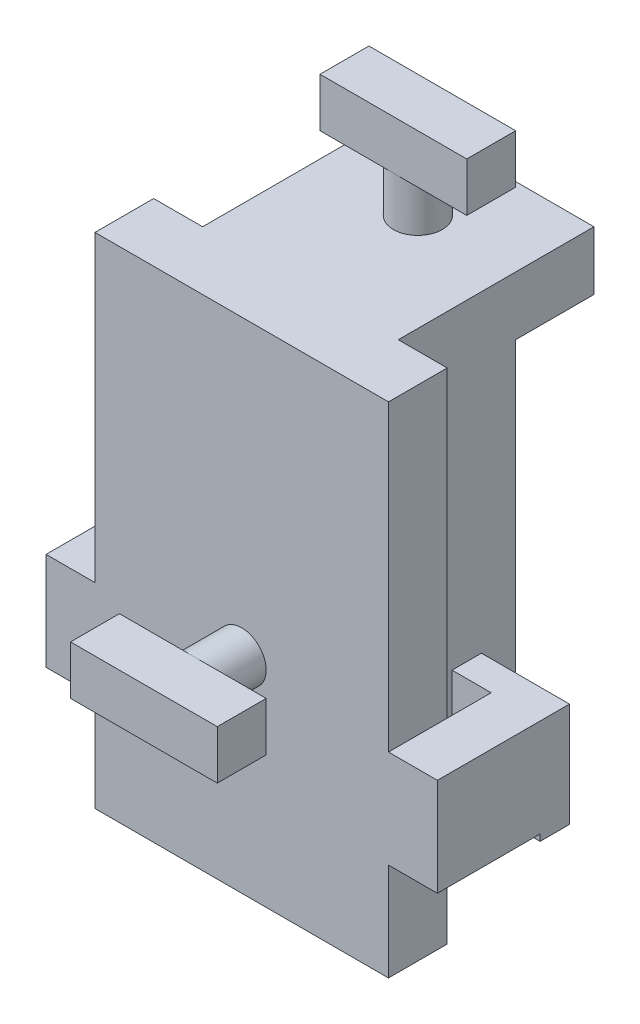
from build123d import *

# Parameters (mm, degrees)
SKETCH_1_W               = 20
SKETCH_1_H               = 45
EXTRUDE_1_DEPTH          = 12
SKETCH_2_W               = 20
SKETCH_2_H               = 20
SKETCH_2_R               = 1.5
EXTRUDE_2_DEPTH          = 6
CUT_EXTRUDE_1_DEPTH      = 57.080299571
CUT_EXTRUDE_1_DEPTH_BACK = 57.080299571
SKETCH_3_R               = 1.5
SKETCH_4_W               = 30
SKETCH_4_H               = 51
EXTRUDE_3_DEPTH          = 6
SKETCH_5_W               = 10.5
SKETCH_5_H               = 10
EXTRUDE_4_DEPTH          = 5
SKETCH_6_W               = 9
SKETCH_6_H               = 10.658350912
EXTRUDE_5_DEPTH          = 3
SKETCH_7_W               = 10.5
SKETCH_7_H               = 10
EXTRUDE_6_DEPTH          = 5
SKETCH_8_W               = 9
SKETCH_8_H               = 10.144867035
EXTRUDE_7_DEPTH          = 3
SKETCH_9_R               = 2.5
EXTRUDE_8_DEPTH          = 10
SKETCH_10_W              = 15
SKETCH_10_H              = 5
EXTRUDE_9_DEPTH          = 5
SKETCH_11_R              = 2.5
EXTRUDE_10_DEPTH         = 10
SKETCH_12_W              = 15
SKETCH_12_H              = 5
EXTRUDE_11_DEPTH         = 5


with BuildPart() as part:
    # ｽｹｯﾁ1 → ﾎﾞｽ - 押し出し1 (new body)
    with BuildSketch(Plane.XY):
        with Locations((10, 22.5)):
            Rectangle(SKETCH_1_W, SKETCH_1_H)
    extrude(amount=EXTRUDE_1_DEPTH)

    # ｽｹｯﾁ2 → ﾎﾞｽ - 押し出し2 (add)
    with BuildSketch(Plane(origin=(0, 45, 0), x_dir=(1, 0, 0), z_dir=(0, 1, 0))):
        with Locations((10, -2)):
            Rectangle(SKETCH_2_W, SKETCH_2_H)
        with Locations(Location((10, 5, 0), (0, 0, 270))):
            Circle(SKETCH_2_R, mode=Mode.SUBTRACT)
    extrude(amount=EXTRUDE_2_DEPTH)

    # ｽｹｯﾁ3 → ｶｯﾄ - 押し出し1 (cut, two sides: drawn at the far end of the back side and taken through both)
    with BuildSketch(Plane(origin=(20, 0, 0), x_dir=(0, 0, -1), z_dir=(1, 0, 0)).offset(-CUT_EXTRUDE_1_DEPTH_BACK)):
        with Locations(Location((-3, 5, 0), (0, 0, 90))):
            Circle(SKETCH_3_R)
    extrude(amount=CUT_EXTRUDE_1_DEPTH + CUT_EXTRUDE_1_DEPTH_BACK, mode=Mode.SUBTRACT)

    # ｽｹｯﾁ4 → ﾎﾞｽ - 押し出し3 (add)
    with BuildSketch(Plane.XY.offset(12)):
        with Locations((10, 25.5)):
            Rectangle(SKETCH_4_W, SKETCH_4_H)
    extrude(amount=EXTRUDE_3_DEPTH)

    # ｽｹｯﾁ5 → ﾎﾞｽ - 押し出し4 (add)
    with BuildSketch(Plane(origin=(25, 0, 0), x_dir=(0, 0, -1), z_dir=(1, 0, 0))):
        with Locations((-12.75, 15)):
            Rectangle(SKETCH_5_W, SKETCH_5_H)
    extrude(amount=EXTRUDE_4_DEPTH)

    # ｽｹｯﾁ6 → ﾎﾞｽ - 押し出し5 (add)
    with BuildSketch(Plane(origin=(0, 0, 7.5), x_dir=(-1, 0, 0), z_dir=(0, 0, -1))):
        with Locations((-25.5, 14.670824544)):
            Rectangle(SKETCH_6_W, SKETCH_6_H)
    extrude(amount=EXTRUDE_5_DEPTH)

    # ｽｹｯﾁ7 → ﾎﾞｽ - 押し出し6 (add)
    with BuildSketch(Plane.ZY.offset(5)):
        with Locations((12.75, 15)):
            Rectangle(SKETCH_7_W, SKETCH_7_H)
    extrude(amount=EXTRUDE_6_DEPTH)

    # ｽｹｯﾁ8 → ﾎﾞｽ - 押し出し7 (add)
    with BuildSketch(Plane(origin=(0, 0, 7.5), x_dir=(-1, 0, 0), z_dir=(0, 0, -1))):
        with Locations((5.5, 15.072433518)):
            Rectangle(SKETCH_8_W, SKETCH_8_H)
    extrude(amount=EXTRUDE_7_DEPTH)

    # ｽｹｯﾁ9 → ﾎﾞｽ - 押し出し8 (add)
    with BuildSketch(Plane(origin=(0, 51, 0), x_dir=(1, 0, 0), z_dir=(0, 1, 0))):
        with Locations(Location((10, 0, 0), (0, 0, 90))):
            Circle(SKETCH_9_R)
    extrude(amount=EXTRUDE_8_DEPTH)

    # ｽｹｯﾁ10 → ﾎﾞｽ - 押し出し9 (add)
    with BuildSketch(Plane(origin=(0, 61, 0), x_dir=(1, 0, 0), z_dir=(0, 1, 0))):
        with Locations((10, 0)):
            Rectangle(SKETCH_10_W, SKETCH_10_H)
    extrude(amount=-EXTRUDE_9_DEPTH)

    # ｽｹｯﾁ11 → ﾎﾞｽ - 押し出し10 (add)
    with BuildSketch(Plane.XY.offset(18)):
        with Locations((10, 21)):
            Circle(SKETCH_11_R)
    extrude(amount=EXTRUDE_10_DEPTH)

    # ｽｹｯﾁ12 → ﾎﾞｽ - 押し出し11 (add)
    with BuildSketch(Plane.XY.offset(28)):
        with Locations((10, 21)):
            Rectangle(SKETCH_12_W, SKETCH_12_H)
    extrude(amount=-EXTRUDE_11_DEPTH)


solid = part.part
